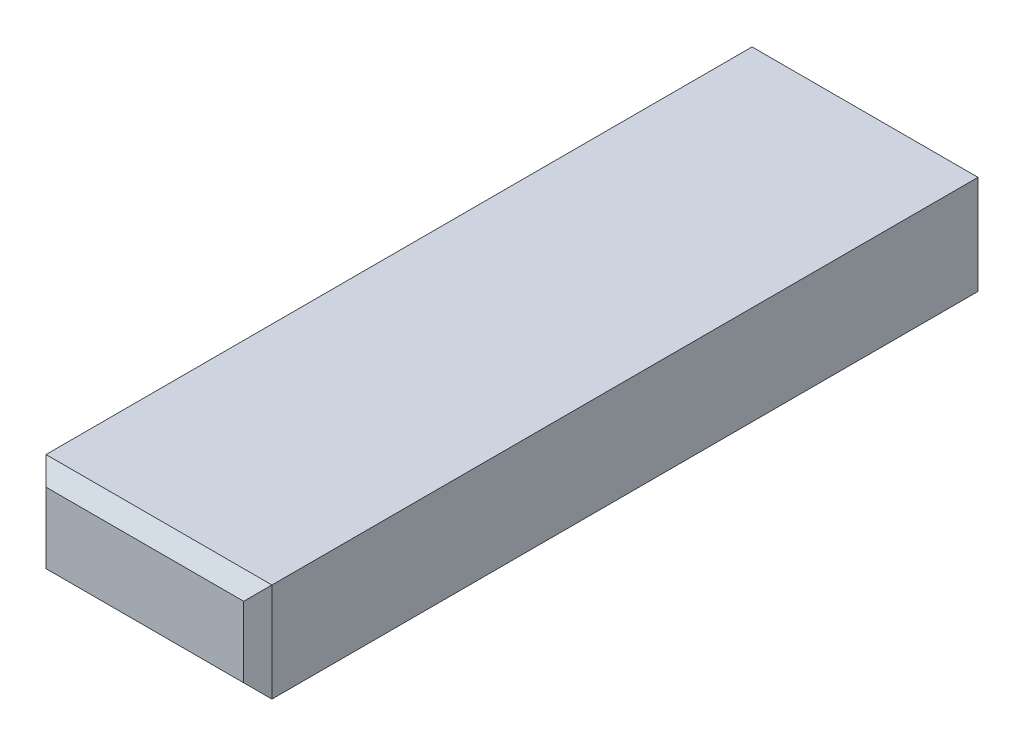
from build123d import *

# Parameters (mm, degrees)
SKETCH1_W           = 8
SKETCH1_H           = 3.5
BOSS_EXTRUDE1_DEPTH = 5
SKETCH2_W           = 8
SKETCH2_H           = 3.5
BOSS_EXTRUDE2_DEPTH = 8
CHAMFER1_SIZE       = 0.5


with BuildPart() as part:
    # Sketch1 → Boss-Extrude1 (new, symmetric)
    with BuildSketch(Plane.XY):
        Rectangle(SKETCH1_W, SKETCH1_H)
    extrude(amount=BOSS_EXTRUDE1_DEPTH, both=True)

    # Sketch2 → Boss-Extrude2 (add)
    with BuildSketch(Plane(origin=(0, 0, -5), x_dir=(-1, 0, 0), z_dir=(0, 0, -1))):
        Rectangle(SKETCH2_W, SKETCH2_H)
    boss_extrude2 = extrude(amount=BOSS_EXTRUDE2_DEPTH)

    # Mirror1: Boss-Extrude2 across plane
    add(boss_extrude2.mirror(Plane.XY))

    # Chamfer1
    chamfer1_edges = [part.edges().sort_by_distance(p)[0] for p in [
        (-4, 0, -13),
        (0, 1.75, -13),
        (4, 0, -13),
        (0, -1.75, -13),
        (-4, 0, 13),
        (0, -1.75, 13),
        (4, 0, 13),
        (0, 1.75, 13),
    ]]
    chamfer(chamfer1_edges, length=CHAMFER1_SIZE)


solid = part.part
